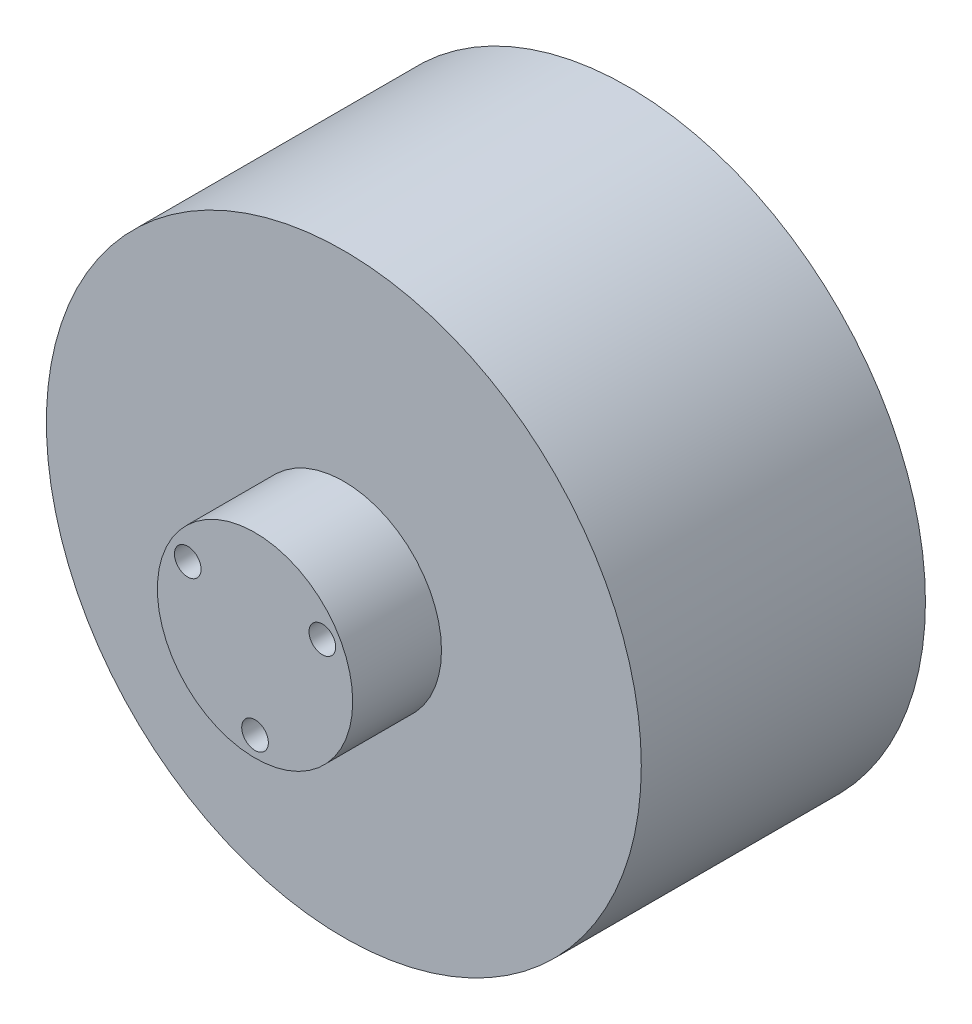
from build123d import *

# Parameters (mm, degrees)
SKETCH_1_R          = 16.5
EXTRUDE_1_DEPTH     = 2.5
SKETCH_2_R          = 33.5
EXTRUDE_2_DEPTH     = 32
SKETCH_3_R          = 11
EXTRUDE_3_DEPTH     = 10
SKETCH_4_R          = 1.5
CUT_EXTRUDE_1_DEPTH = 5
SKETCH_5_R          = 1.5
CUT_EXTRUDE_2_DEPTH = 5


with BuildPart() as part:
    # 草图1 → 凸台-拉伸1 (new body)
    with BuildSketch(Plane.XY):
        Circle(SKETCH_1_R)
    extrude(amount=EXTRUDE_1_DEPTH)

    # 草图2 → 凸台-拉伸2 (add)
    with BuildSketch(Plane.XY.offset(2.5)):
        Circle(SKETCH_2_R)
    extrude(amount=EXTRUDE_2_DEPTH)

    # 草图3 → 凸台-拉伸3 (add)
    with BuildSketch(Plane.XY.offset(34.5)):
        Circle(SKETCH_3_R)
    extrude(amount=EXTRUDE_3_DEPTH)

    # 草图4 → 切除-拉伸1 (cut)
    with BuildSketch(Plane.XY.offset(44.5)):
        with Locations((7.577722283, 4.375)):
            Circle(SKETCH_4_R)
        with Locations((-7.577722283, 4.375)):
            Circle(SKETCH_4_R)
        with Locations((0, -8.75)):
            Circle(SKETCH_4_R)
    extrude(amount=-CUT_EXTRUDE_1_DEPTH, mode=Mode.SUBTRACT)

    # 草图5 → 切除-拉伸2 (cut)
    with BuildSketch(Plane(origin=(0, 0, 0), x_dir=(-1, 0, 0), z_dir=(0, 0, -1))):
        with Locations((0, -14)):
            Circle(SKETCH_5_R)
        with Locations((-12.124355653, 7)):
            Circle(SKETCH_5_R)
        with Locations((12.124355653, 7)):
            Circle(SKETCH_5_R)
    extrude(amount=-CUT_EXTRUDE_2_DEPTH, mode=Mode.SUBTRACT)


solid = part.part
